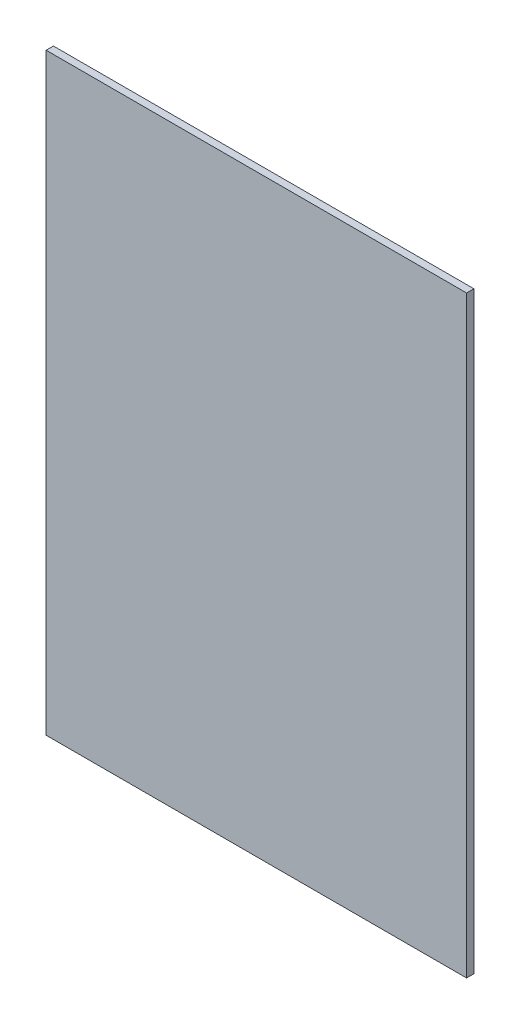
from build123d import *

# Parameters (mm, degrees)
SKETCH1_W           = 172.8
SKETCH1_H           = 243.83
BOSS_EXTRUDE1_DEPTH = 3


with BuildPart() as part:
    # Sketch1 → Boss-Extrude1 (new body)
    with BuildSketch(Plane.XY):
        with Locations((86.4, 121.915)):
            Rectangle(SKETCH1_W, SKETCH1_H)
    extrude(amount=BOSS_EXTRUDE1_DEPTH)


solid = part.part
